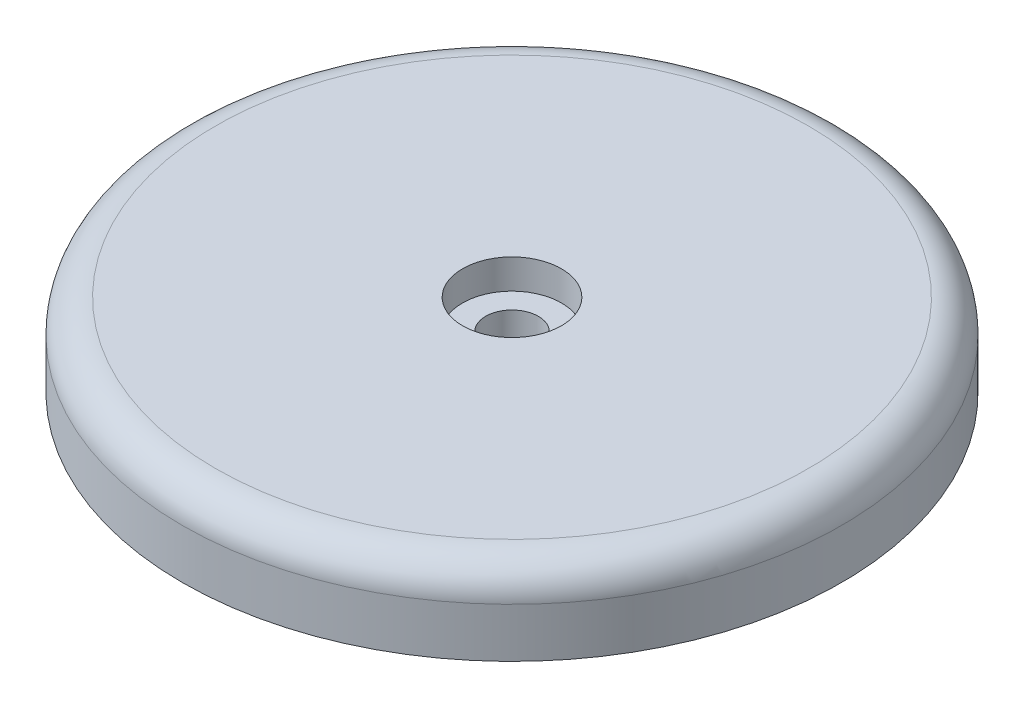
from build123d import *

# Parameters (mm, degrees)
SKETCH_1_R          = 20
EXTRUDE_1_DEPTH     = 5
FILLET_1_R          = 2
SKETCH_2_R          = 3
CUT_EXTRUDE_1_DEPTH = 1.8
SKETCH_3_R          = 1.6
CUT_EXTRUDE_2_DEPTH = 29.46471507


with BuildPart() as part:
    # 草图1 → 凸台-拉伸1 (new body)
    with BuildSketch(Plane(origin=(0, 0, 0), x_dir=(1, 0, 0), z_dir=(0, 1, 0))):
        with Locations(Location((0, 0, 0), (0, 0, 270))):
            Circle(SKETCH_1_R)
    extrude(amount=EXTRUDE_1_DEPTH)

    # 圆角1
    fillet_1_edges = [part.edges().sort_by_distance(p)[0] for p in [
        (0, 5, -20),
    ]]
    fillet(fillet_1_edges, radius=FILLET_1_R)

    # 草图2 → 切除-拉伸1 (cut)
    with BuildSketch(Plane(origin=(0, 5, 0), x_dir=(1, 0, 0), z_dir=(0, 1, 0))):
        with Locations(Location((0, 0, 0), (0, 0, 270))):
            Circle(SKETCH_2_R)
    extrude(amount=-CUT_EXTRUDE_1_DEPTH, mode=Mode.SUBTRACT)

    # 草图3 → 切除-拉伸2 (cut, through all)
    with BuildSketch(Plane(origin=(0, 3.2, 0), x_dir=(1, 0, 0), z_dir=(0, 1, 0))):
        with Locations(Location((0, 0, 0), (0, 0, 270))):
            Circle(SKETCH_3_R)
    extrude(amount=-CUT_EXTRUDE_2_DEPTH, mode=Mode.SUBTRACT)


solid = part.part
